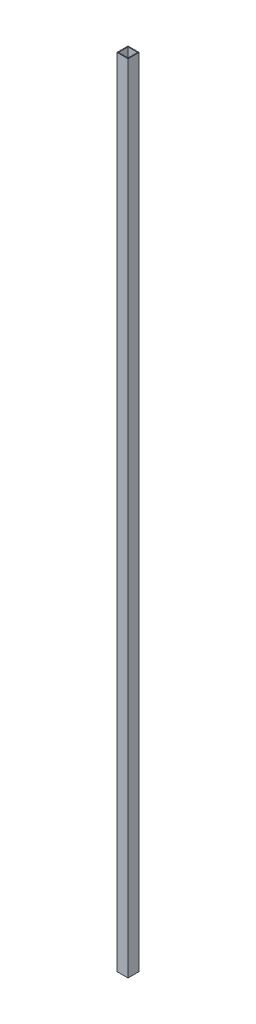
from build123d import *

# Parameters (mm, degrees)
SKETCH1_W           = 25.4
SKETCH1_H           = 25.4
SKETCH1_W_2         = 22.225
SKETCH1_H_2         = 22.225
BOSS_EXTRUDE1_DEPTH = 1828.8


with BuildPart() as part:
    # Sketch1 → Boss-Extrude1 (new body)
    with BuildSketch(Plane(origin=(0, 0, 0), x_dir=(1, 0, 0), z_dir=(0, 1, 0))):
        Rectangle(SKETCH1_W, SKETCH1_H)
        Rectangle(SKETCH1_W_2, SKETCH1_H_2, mode=Mode.SUBTRACT)
    extrude(amount=BOSS_EXTRUDE1_DEPTH)


solid = part.part
